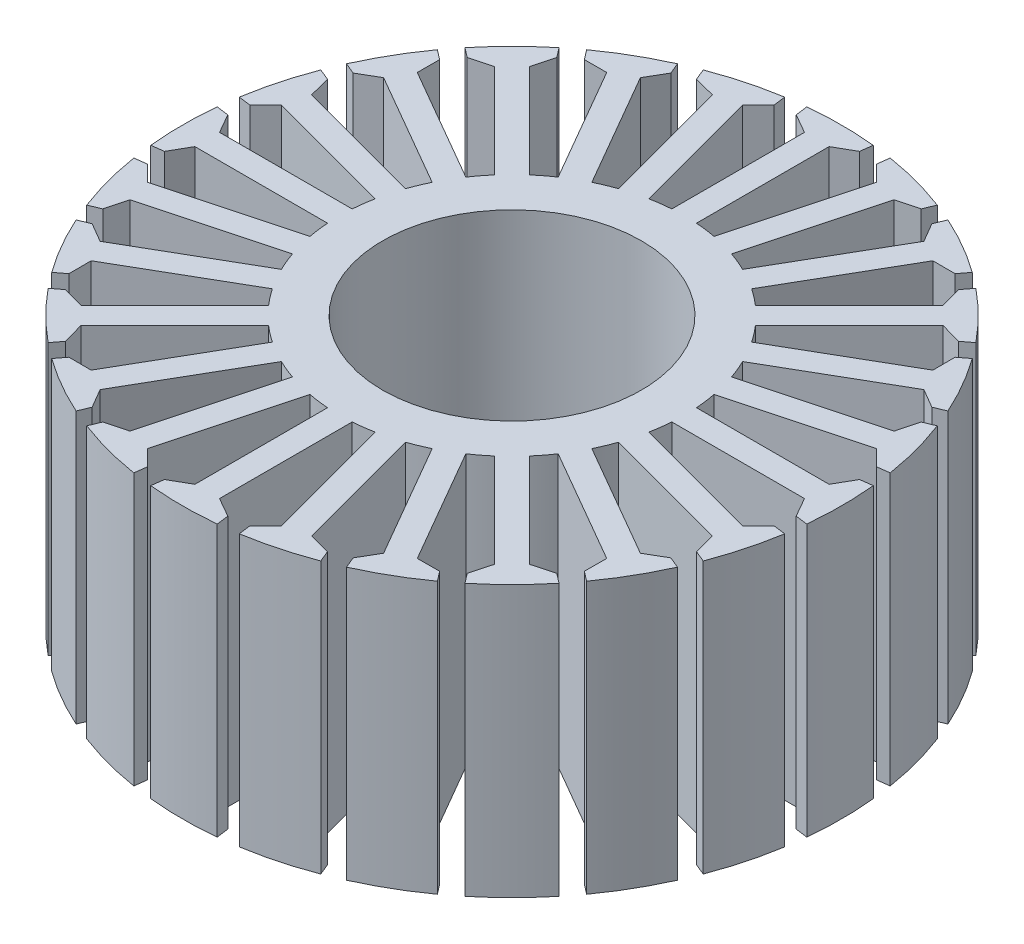
from build123d import *

# Parameters (mm, degrees)
SKETCH5_R           = 10.5
BOSS_EXTRUDE1_DEPTH = 22


with BuildPart() as part:
    # Sketch5 → Boss-Extrude1 (new body)
    with BuildSketch(Plane(origin=(0, 0, 0), x_dir=(1, 0, 0), z_dir=(0, 1, 0))):
        with BuildLine():
            Line((-1, 24.729789728), (-1, 13.964240044))
            ThreePointArc((-1, 13.964240044), (-1.827366691, 13.880228059), (-2.648285447, 13.747239148))
            Line((-2.648285447, 13.747239148), (-5.434614737, 24.145961622))
            Line((-5.434614737, 24.145961622), (-4.151548547, 25.418492807))
            Line((-4.151548547, 25.418492807), (-4.281443911, 26.405146052))
            ThreePointArc((-4.281443911, 26.405146052), (-6.923409456, 25.838515853), (-9.494733835, 25.008249227))
            Line((-9.494733835, 25.008249227), (-9.113899897, 24.08883477))
            Line((-9.113899897, 24.08883477), (-7.366466389, 23.628323532))
            Line((-7.366466389, 23.628323532), (-4.5801371, 13.229601058))
            ThreePointArc((-4.5801371, 13.229601058), (-5.357568053, 12.934313455), (-6.116094618, 12.593386622))
            Line((-6.116094618, 12.593386622), (-11.49886946, 21.916626135))
            Line((-11.49886946, 21.916626135), (-10.588877996, 23.477878837))
            Line((-10.588877996, 23.477878837), (-10.969711934, 24.397293294))
            ThreePointArc((-10.969711934, 24.397293294), (-13.375, 23.166179551), (-15.643819809, 21.698695854))
            Line((-15.643819809, 21.698695854), (-15.038000502, 20.909176761))
            Line((-15.038000502, 20.909176761), (-13.230920268, 20.916626135))
            Line((-13.230920268, 20.916626135), (-7.848145426, 11.593386622))
            ThreePointArc((-7.848145426, 11.593386622), (-8.522660006, 11.106946764), (-9.167102048, 10.58131561))
            Line((-9.167102048, 10.58131561), (-16.779495233, 18.193708795))
            Line((-16.779495233, 18.193708795), (-16.30459291, 19.937286223))
            Line((-16.30459291, 19.937286223), (-16.910412218, 20.726805317))
            ThreePointArc((-16.910412218, 20.726805317), (-18.915106397, 18.915106397), (-20.726805317, 16.910412218))
            Line((-20.726805317, 16.910412218), (-19.937286223, 16.30459291))
            Line((-19.937286223, 16.30459291), (-18.193708795, 16.779495233))
            Line((-18.193708795, 16.779495233), (-10.58131561, 9.167102048))
            ThreePointArc((-10.58131561, 9.167102048), (-11.106946764, 8.522660006), (-11.593386622, 7.848145426))
            Line((-11.593386622, 7.848145426), (-20.916626135, 13.230920268))
            Line((-20.916626135, 13.230920268), (-20.909176761, 15.038000502))
            Line((-20.909176761, 15.038000502), (-21.698695854, 15.643819809))
            ThreePointArc((-21.698695854, 15.643819809), (-23.166179551, 13.375), (-24.397293294, 10.969711934))
            Line((-24.397293294, 10.969711934), (-23.477878837, 10.588877996))
            Line((-23.477878837, 10.588877996), (-21.916626135, 11.49886946))
            Line((-21.916626135, 11.49886946), (-12.593386622, 6.116094618))
            ThreePointArc((-12.593386622, 6.116094618), (-12.934313455, 5.357568053), (-13.229601058, 4.5801371))
            Line((-13.229601058, 4.5801371), (-23.628323532, 7.366466389))
            Line((-23.628323532, 7.366466389), (-24.08883477, 9.113899897))
            Line((-24.08883477, 9.113899897), (-25.008249227, 9.494733835))
            ThreePointArc((-25.008249227, 9.494733835), (-25.838515853, 6.923409456), (-26.405146052, 4.281443911))
            Line((-26.405146052, 4.281443911), (-25.418492807, 4.151548547))
            Line((-25.418492807, 4.151548547), (-24.145961622, 5.434614737))
            Line((-24.145961622, 5.434614737), (-13.747239148, 2.648285447))
            ThreePointArc((-13.747239148, 2.648285447), (-13.880228059, 1.827366691), (-13.964240044, 1))
            Line((-13.964240044, 1), (-24.729789728, 1))
            Line((-24.729789728, 1), (-25.626878498, 2.568702076))
            Line((-25.626878498, 2.568702076), (-26.613531743, 2.69859744))
            ThreePointArc((-26.613531743, 2.69859744), (-26.75, 0), (-26.613531743, -2.69859744))
            Line((-26.613531743, -2.69859744), (-25.626878498, -2.568702076))
            Line((-25.626878498, -2.568702076), (-24.729789728, -1))
            Line((-24.729789728, -1), (-13.964240044, -1))
            ThreePointArc((-13.964240044, -1), (-13.880228059, -1.827366691), (-13.747239148, -2.648285447))
            Line((-13.747239148, -2.648285447), (-24.145961622, -5.434614737))
            Line((-24.145961622, -5.434614737), (-25.418492807, -4.151548547))
            Line((-25.418492807, -4.151548547), (-26.405146052, -4.281443911))
            ThreePointArc((-26.405146052, -4.281443911), (-25.838515853, -6.923409456), (-25.008249227, -9.494733835))
            Line((-25.008249227, -9.494733835), (-24.08883477, -9.113899897))
            Line((-24.08883477, -9.113899897), (-23.628323532, -7.366466389))
            Line((-23.628323532, -7.366466389), (-13.229601058, -4.5801371))
            ThreePointArc((-13.229601058, -4.5801371), (-12.934313455, -5.357568053), (-12.593386622, -6.116094618))
            Line((-12.593386622, -6.116094618), (-21.916626135, -11.49886946))
            Line((-21.916626135, -11.49886946), (-23.477878837, -10.588877996))
            Line((-23.477878837, -10.588877996), (-24.397293294, -10.969711934))
            ThreePointArc((-24.397293294, -10.969711934), (-23.166179551, -13.375), (-21.698695854, -15.643819809))
            Line((-21.698695854, -15.643819809), (-20.909176761, -15.038000502))
            Line((-20.909176761, -15.038000502), (-20.916626135, -13.230920268))
            Line((-20.916626135, -13.230920268), (-11.593386622, -7.848145426))
            ThreePointArc((-11.593386622, -7.848145426), (-11.106946764, -8.522660006), (-10.58131561, -9.167102048))
            Line((-10.58131561, -9.167102048), (-18.193708795, -16.779495233))
            Line((-18.193708795, -16.779495233), (-19.937286223, -16.30459291))
            Line((-19.937286223, -16.30459291), (-20.726805317, -16.910412218))
            ThreePointArc((-20.726805317, -16.910412218), (-18.915106397, -18.915106397), (-16.910412218, -20.726805317))
            Line((-16.910412218, -20.726805317), (-16.30459291, -19.937286223))
            Line((-16.30459291, -19.937286223), (-16.779495233, -18.193708795))
            Line((-16.779495233, -18.193708795), (-9.167102048, -10.58131561))
            ThreePointArc((-9.167102048, -10.58131561), (-8.522660006, -11.106946764), (-7.848145426, -11.593386622))
            Line((-7.848145426, -11.593386622), (-13.230920268, -20.916626135))
            Line((-13.230920268, -20.916626135), (-15.038000502, -20.909176761))
            Line((-15.038000502, -20.909176761), (-15.643819809, -21.698695854))
            ThreePointArc((-15.643819809, -21.698695854), (-13.375, -23.166179551), (-10.969711934, -24.397293294))
            Line((-10.969711934, -24.397293294), (-10.588877996, -23.477878837))
            Line((-10.588877996, -23.477878837), (-11.49886946, -21.916626135))
            Line((-11.49886946, -21.916626135), (-6.116094618, -12.593386622))
            ThreePointArc((-6.116094618, -12.593386622), (-5.357568053, -12.934313455), (-4.5801371, -13.229601058))
            Line((-4.5801371, -13.229601058), (-7.366466389, -23.628323532))
            Line((-7.366466389, -23.628323532), (-9.113899897, -24.08883477))
            Line((-9.113899897, -24.08883477), (-9.494733835, -25.008249227))
            ThreePointArc((-9.494733835, -25.008249227), (-6.923409456, -25.838515853), (-4.281443911, -26.405146052))
            Line((-4.281443911, -26.405146052), (-4.151548547, -25.418492807))
            Line((-4.151548547, -25.418492807), (-5.434614737, -24.145961622))
            Line((-5.434614737, -24.145961622), (-2.648285447, -13.747239148))
            ThreePointArc((-2.648285447, -13.747239148), (-1.827366691, -13.880228059), (-1, -13.964240044))
            Line((-1, -13.964240044), (-1, -24.729789728))
            Line((-1, -24.729789728), (-2.568702076, -25.626878498))
            Line((-2.568702076, -25.626878498), (-2.69859744, -26.613531743))
            ThreePointArc((-2.69859744, -26.613531743), (0, -26.75), (2.69859744, -26.613531743))
            Line((2.69859744, -26.613531743), (2.568702076, -25.626878498))
            Line((2.568702076, -25.626878498), (1, -24.729789728))
            Line((1, -24.729789728), (1, -13.964240044))
            ThreePointArc((1, -13.964240044), (1.827366691, -13.880228059), (2.648285447, -13.747239148))
            Line((2.648285447, -13.747239148), (5.434614737, -24.145961622))
            Line((5.434614737, -24.145961622), (4.151548547, -25.418492807))
            Line((4.151548547, -25.418492807), (4.281443911, -26.405146052))
            ThreePointArc((4.281443911, -26.405146052), (6.923409456, -25.838515853), (9.494733835, -25.008249227))
            Line((9.494733835, -25.008249227), (9.113899897, -24.08883477))
            Line((9.113899897, -24.08883477), (7.366466389, -23.628323532))
            Line((7.366466389, -23.628323532), (4.5801371, -13.229601058))
            ThreePointArc((4.5801371, -13.229601058), (5.357568053, -12.934313455), (6.116094618, -12.593386622))
            Line((6.116094618, -12.593386622), (11.49886946, -21.916626135))
            Line((11.49886946, -21.916626135), (10.588877996, -23.477878837))
            Line((10.588877996, -23.477878837), (10.969711934, -24.397293294))
            ThreePointArc((10.969711934, -24.397293294), (13.375, -23.166179551), (15.643819809, -21.698695854))
            Line((15.643819809, -21.698695854), (15.038000502, -20.909176761))
            Line((15.038000502, -20.909176761), (13.230920268, -20.916626135))
            Line((13.230920268, -20.916626135), (7.848145426, -11.593386622))
            ThreePointArc((7.848145426, -11.593386622), (8.522660006, -11.106946764), (9.167102048, -10.58131561))
            Line((9.167102048, -10.58131561), (16.779495233, -18.193708795))
            Line((16.779495233, -18.193708795), (16.30459291, -19.937286223))
            Line((16.30459291, -19.937286223), (16.910412218, -20.726805317))
            ThreePointArc((16.910412218, -20.726805317), (18.915106397, -18.915106397), (20.726805317, -16.910412218))
            Line((20.726805317, -16.910412218), (19.937286223, -16.30459291))
            Line((19.937286223, -16.30459291), (18.193708795, -16.779495233))
            Line((18.193708795, -16.779495233), (10.58131561, -9.167102048))
            ThreePointArc((10.58131561, -9.167102048), (11.106946764, -8.522660006), (11.593386622, -7.848145426))
            Line((11.593386622, -7.848145426), (20.916626135, -13.230920268))
            Line((20.916626135, -13.230920268), (20.909176761, -15.038000502))
            Line((20.909176761, -15.038000502), (21.698695854, -15.643819809))
            ThreePointArc((21.698695854, -15.643819809), (23.166179551, -13.375), (24.397293294, -10.969711934))
            Line((24.397293294, -10.969711934), (23.477878837, -10.588877996))
            Line((23.477878837, -10.588877996), (21.916626135, -11.49886946))
            Line((21.916626135, -11.49886946), (12.593386622, -6.116094618))
            ThreePointArc((12.593386622, -6.116094618), (12.934313455, -5.357568053), (13.229601058, -4.5801371))
            Line((13.229601058, -4.5801371), (23.628323532, -7.366466389))
            Line((23.628323532, -7.366466389), (24.08883477, -9.113899897))
            Line((24.08883477, -9.113899897), (25.008249227, -9.494733835))
            ThreePointArc((25.008249227, -9.494733835), (25.838515853, -6.923409456), (26.405146052, -4.281443911))
            Line((26.405146052, -4.281443911), (25.418492807, -4.151548547))
            Line((25.418492807, -4.151548547), (24.145961622, -5.434614737))
            Line((24.145961622, -5.434614737), (13.747239148, -2.648285447))
            ThreePointArc((13.747239148, -2.648285447), (13.880228059, -1.827366691), (13.964240044, -1))
            Line((13.964240044, -1), (24.729789728, -1))
            Line((24.729789728, -1), (25.626878498, -2.568702076))
            Line((25.626878498, -2.568702076), (26.613531743, -2.69859744))
            ThreePointArc((26.613531743, -2.69859744), (26.75, 0), (26.613531743, 2.69859744))
            Line((26.613531743, 2.69859744), (25.626878498, 2.568702076))
            Line((25.626878498, 2.568702076), (24.729789728, 1))
            Line((24.729789728, 1), (13.964240044, 1))
            ThreePointArc((13.964240044, 1), (13.880228059, 1.827366691), (13.747239148, 2.648285447))
            Line((13.747239148, 2.648285447), (24.145961622, 5.434614737))
            Line((24.145961622, 5.434614737), (25.418492807, 4.151548547))
            Line((25.418492807, 4.151548547), (26.405146052, 4.281443911))
            ThreePointArc((26.405146052, 4.281443911), (25.838515853, 6.923409456), (25.008249227, 9.494733835))
            Line((25.008249227, 9.494733835), (24.08883477, 9.113899897))
            Line((24.08883477, 9.113899897), (23.628323532, 7.366466389))
            Line((23.628323532, 7.366466389), (13.229601058, 4.5801371))
            ThreePointArc((13.229601058, 4.5801371), (12.934313455, 5.357568053), (12.593386622, 6.116094618))
            Line((12.593386622, 6.116094618), (21.916626135, 11.49886946))
            Line((21.916626135, 11.49886946), (23.477878837, 10.588877996))
            Line((23.477878837, 10.588877996), (24.397293294, 10.969711934))
            ThreePointArc((24.397293294, 10.969711934), (23.166179551, 13.375), (21.698695854, 15.643819809))
            Line((21.698695854, 15.643819809), (20.909176761, 15.038000502))
            Line((20.909176761, 15.038000502), (20.916626135, 13.230920268))
            Line((20.916626135, 13.230920268), (11.593386622, 7.848145426))
            ThreePointArc((11.593386622, 7.848145426), (11.106946764, 8.522660006), (10.58131561, 9.167102048))
            Line((10.58131561, 9.167102048), (18.193708795, 16.779495233))
            Line((18.193708795, 16.779495233), (19.937286223, 16.30459291))
            Line((19.937286223, 16.30459291), (20.726805317, 16.910412218))
            ThreePointArc((20.726805317, 16.910412218), (18.915106397, 18.915106397), (16.910412218, 20.726805317))
            Line((16.910412218, 20.726805317), (16.30459291, 19.937286223))
            Line((16.30459291, 19.937286223), (16.779495233, 18.193708795))
            Line((16.779495233, 18.193708795), (9.167102048, 10.58131561))
            ThreePointArc((9.167102048, 10.58131561), (8.522660006, 11.106946764), (7.848145426, 11.593386622))
            Line((7.848145426, 11.593386622), (13.230920268, 20.916626135))
            Line((13.230920268, 20.916626135), (15.038000502, 20.909176761))
            Line((15.038000502, 20.909176761), (15.643819809, 21.698695854))
            ThreePointArc((15.643819809, 21.698695854), (13.375, 23.166179551), (10.969711934, 24.397293294))
            Line((10.969711934, 24.397293294), (10.588877996, 23.477878837))
            Line((10.588877996, 23.477878837), (11.49886946, 21.916626135))
            Line((11.49886946, 21.916626135), (6.116094618, 12.593386622))
            ThreePointArc((6.116094618, 12.593386622), (5.357568053, 12.934313455), (4.5801371, 13.229601058))
            Line((4.5801371, 13.229601058), (7.366466389, 23.628323532))
            Line((7.366466389, 23.628323532), (9.113899897, 24.08883477))
            Line((9.113899897, 24.08883477), (9.494733835, 25.008249227))
            ThreePointArc((9.494733835, 25.008249227), (6.923409456, 25.838515853), (4.281443911, 26.405146052))
            Line((4.281443911, 26.405146052), (4.151548547, 25.418492807))
            Line((4.151548547, 25.418492807), (5.434614737, 24.145961622))
            Line((5.434614737, 24.145961622), (2.648285447, 13.747239148))
            ThreePointArc((2.648285447, 13.747239148), (1.827366691, 13.880228059), (1, 13.964240044))
            Line((1, 13.964240044), (1, 24.729789728))
            Line((1, 24.729789728), (2.568702076, 25.626878498))
            Line((2.568702076, 25.626878498), (2.69859744, 26.613531743))
            ThreePointArc((2.69859744, 26.613531743), (0, 26.75), (-2.69859744, 26.613531743))
            Line((-2.69859744, 26.613531743), (-2.568702076, 25.626878498))
            Line((-2.568702076, 25.626878498), (-1, 24.729789728))
        make_face()
        with Locations(Location((0, 0, 0), (0, 0, 270))):
            Circle(SKETCH5_R, mode=Mode.SUBTRACT)
    extrude(amount=BOSS_EXTRUDE1_DEPTH)


solid = part.part
